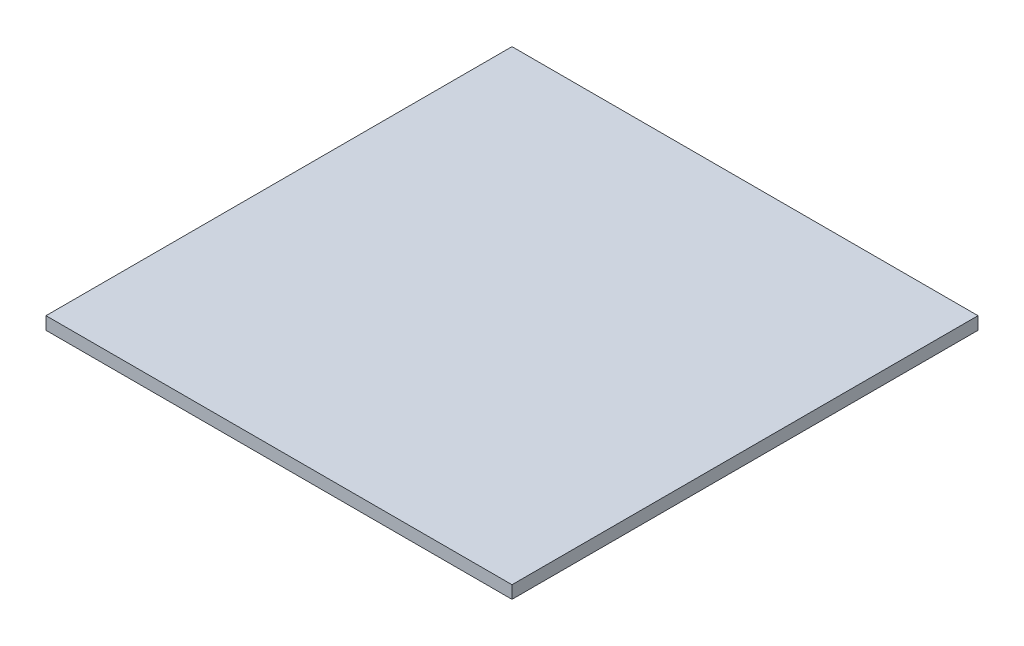
from build123d import *

# Parameters (mm, degrees)
SKETCH_1_W      = 550
SKETCH_1_H      = 550
EXTRUDE_1_DEPTH = 15


with BuildPart() as part:
    # 草图1 → 凸台-拉伸1 (new body)
    with BuildSketch(Plane(origin=(0, 0, 0), x_dir=(1, 0, 0), z_dir=(0, 1, 0))):
        Rectangle(SKETCH_1_W, SKETCH_1_H)
    extrude(amount=EXTRUDE_1_DEPTH)


solid = part.part
